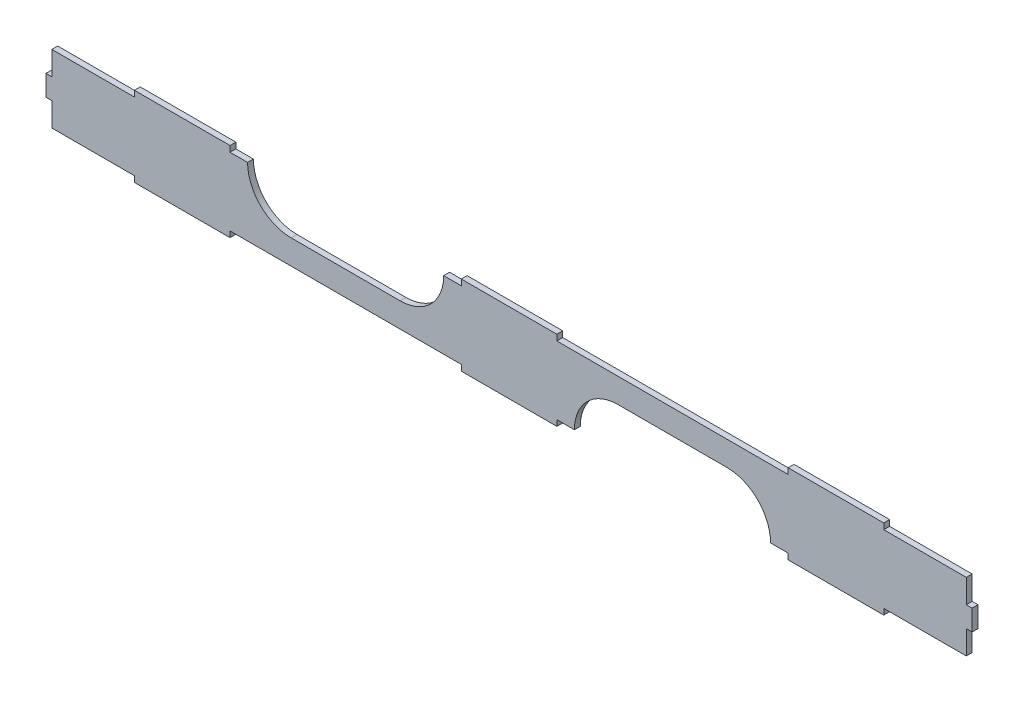
from build123d import *

# Parameters (mm, degrees)
BOSS_EXTRUDE1_DEPTH = 4.3


with BuildPart() as part:
    # Sketch1 → Boss-Extrude1 (new body)
    with BuildSketch(Plane.XY):
        with BuildLine():
            Line((-335.7, -25), (-275.1, -25))
            Line((-275.1, -25), (-275.1, -29.3))
            Line((-275.1, -29.3), (-204.9, -29.3))
            Line((-204.9, -29.3), (-204.9, -25))
            Line((-204.9, -25), (-35.1, -25))
            Line((-35.1, -25), (-35.1, -29.3))
            Line((-35.1, -29.3), (35.1, -29.3))
            Line((35.1, -29.3), (35.1, -25))
            Line((35.1, -25), (48, -25))
            ThreePointArc((48, -25), (57.372583002, -2.372583002), (80, 7))
            Line((80, 7), (160, 7))
            ThreePointArc((160, 7), (182.627416998, -2.372583002), (192, -25))
            Line((192, -25), (204.9, -25))
            Line((204.9, -25), (204.9, -29.3))
            Line((204.9, -29.3), (275.1, -29.3))
            Line((275.1, -29.3), (275.1, -25))
            Line((275.1, -25), (335.7, -25))
            Line((335.7, -25), (335.7, -7.6))
            Line((335.7, -7.6), (340, -7.6))
            Line((340, -7.6), (340, 7.6))
            Line((340, 7.6), (335.7, 7.6))
            Line((335.7, 7.6), (335.7, 25))
            Line((335.7, 25), (275.1, 25))
            Line((275.1, 25), (275.1, 29.3))
            Line((275.1, 29.3), (204.9, 29.3))
            Line((204.9, 29.3), (204.9, 25))
            Line((204.9, 25), (35.1, 25))
            Line((35.1, 25), (35.1, 29.3))
            Line((35.1, 29.3), (-35.1, 29.3))
            Line((-35.1, 29.3), (-35.1, 25))
            Line((-35.1, 25), (-48, 25))
            ThreePointArc((-48, 25), (-57.372583002, 2.372583002), (-80, -7))
            Line((-80, -7), (-160, -7))
            ThreePointArc((-160, -7), (-182.627416998, 2.372583002), (-192, 25))
            Line((-192, 25), (-204.9, 25))
            Line((-204.9, 25), (-204.9, 29.3))
            Line((-204.9, 29.3), (-275.1, 29.3))
            Line((-275.1, 29.3), (-275.1, 25))
            Line((-275.1, 25), (-335.7, 25))
            Line((-335.7, 25), (-335.7, 7.6))
            Line((-335.7, 7.6), (-340, 7.6))
            Line((-340, 7.6), (-340, -7.6))
            Line((-340, -7.6), (-335.7, -7.6))
            Line((-335.7, -7.6), (-335.7, -25))
        make_face()
    extrude(amount=BOSS_EXTRUDE1_DEPTH)


solid = part.part
